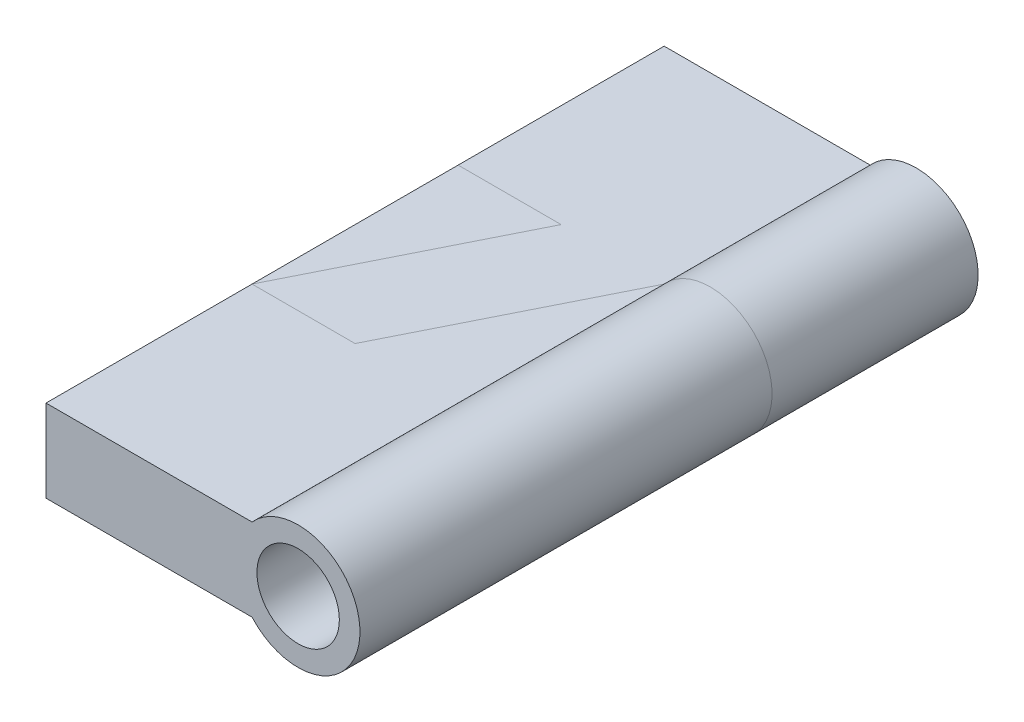
from build123d import *

# Parameters (mm, degrees)
SKETCH_1_R      = 1
EXTRUDE_1_DEPTH = 10
SKETCH_1_2_R    = 1
EXTRUDE_3_DEPTH = 5


with BuildPart() as part:
    # 草图1 → 凸台-拉伸1 (new body)
    with BuildSketch(Plane.XY):
        with BuildLine():
            Line((-6.118033989, 1), (-1.118033989, 1))
            ThreePointArc((-1.118033989, 1), (1.5, 0), (-1.118033989, -1))
            Line((-1.118033989, -1), (-6.118033989, -1))
            Line((-6.118033989, -1), (-6.118033989, 1))
        make_face()
        Circle(SKETCH_1_R, mode=Mode.SUBTRACT)
    extrude(amount=EXTRUDE_1_DEPTH)


with BuildPart() as body_2:
    # 草图1<2> → 凸台-拉伸3 (new, symmetric)
    with BuildSketch(Plane.XY):
        with BuildLine():
            Line((-6.118033989, 1), (-1.118033989, 1))
            ThreePointArc((-1.118033989, 1), (1.5, 0), (-1.118033989, -1))
            Line((-1.118033989, -1), (-6.118033989, -1))
            Line((-6.118033989, -1), (-6.118033989, 1))
        make_face()
        Circle(SKETCH_1_2_R, mode=Mode.SUBTRACT)
    extrude(amount=EXTRUDE_3_DEPTH, both=True)


solid = Compound([part.part, body_2.part])
